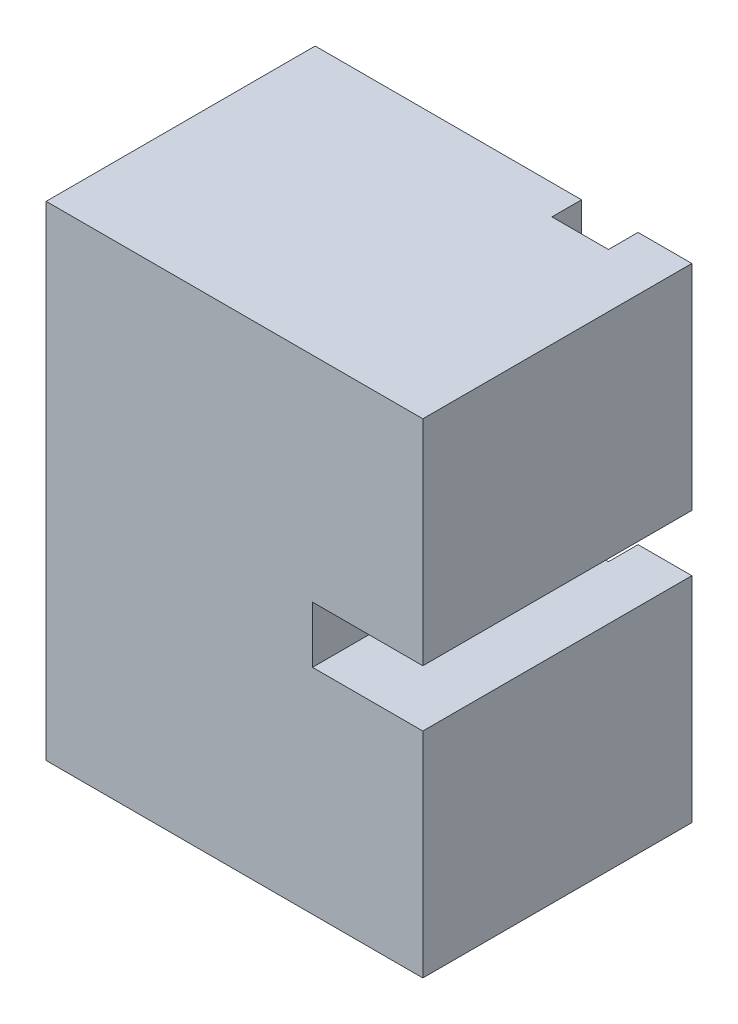
from build123d import *

# Parameters (mm, degrees)
SKICA1_W                      = 70
SKICA1_H                      = 90
P_IDAT_VYSUNUT_M1_DEPTH       = 50
SKICA7_W                      = 20.5
SKICA7_H                      = 10.5
ODEBRAT_VYSUNUT_M3_DEPTH      = 50
ODEBRAT_VYSUNUT_M4_DEPTH      = 60
ODEBRAT_VYSUNUT_M4_DEPTH_BACK = 50
SKICA9_W                      = 10.5
SKICA9_H                      = 5.5


with BuildPart() as part:
    # Skica1 → Přidat vysunutím1 (new body)
    with BuildSketch(Plane.XY):
        with Locations((35, 45)):
            Rectangle(SKICA1_W, SKICA1_H)
    extrude(amount=P_IDAT_VYSUNUT_M1_DEPTH)

    # Skica7 → Odebrat vysunutím3 (cut)
    with BuildSketch(Plane(origin=(0, 0, 0), x_dir=(-1, 0, 0), z_dir=(0, 0, -1))):
        with Locations((-59.75, 45)):
            Rectangle(SKICA7_W, SKICA7_H)
    extrude(amount=-ODEBRAT_VYSUNUT_M3_DEPTH, mode=Mode.SUBTRACT)

    # Skica9 → Odebrat vysunutím4 (cut, two sides: drawn at the far end of the back side and taken through both)
    with BuildSketch(Plane.XZ.offset(-50.25).offset(-ODEBRAT_VYSUNUT_M4_DEPTH_BACK)):
        with Locations((54.75, 2.75)):
            Rectangle(SKICA9_W, SKICA9_H)
    extrude(amount=ODEBRAT_VYSUNUT_M4_DEPTH + ODEBRAT_VYSUNUT_M4_DEPTH_BACK, mode=Mode.SUBTRACT)


solid = part.part
